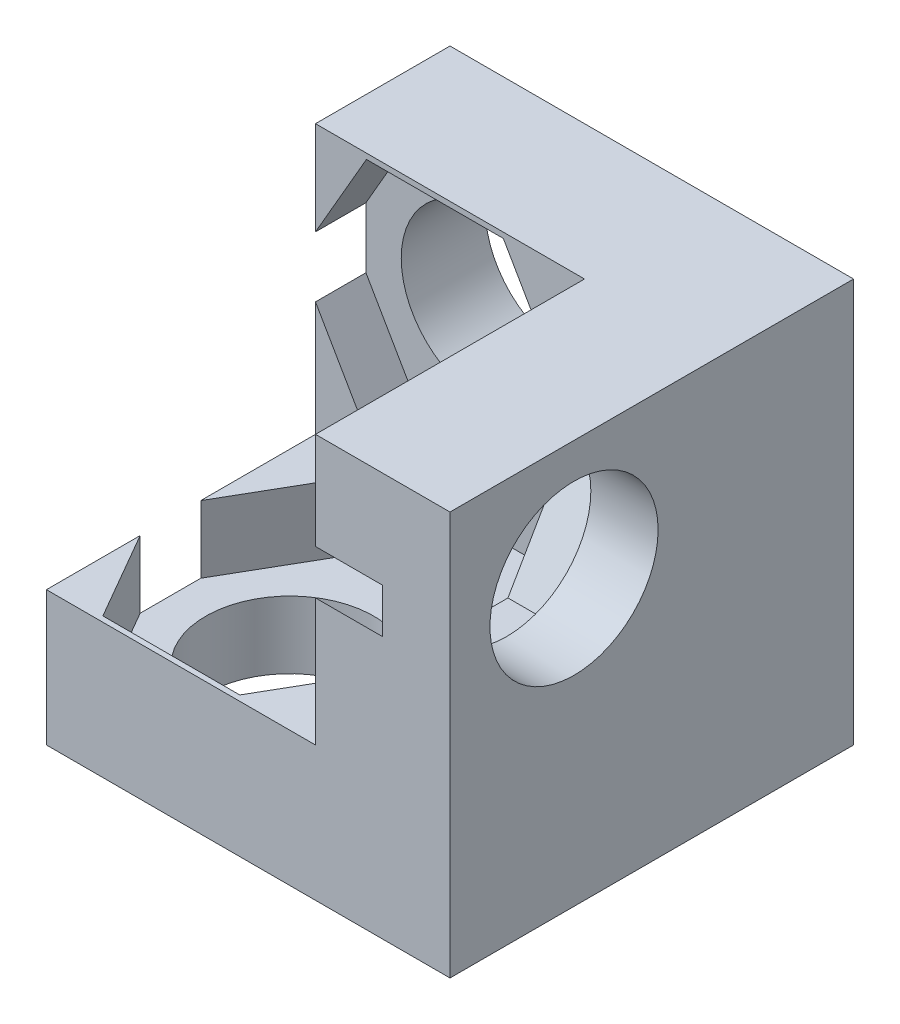
from build123d import *

# Parameters (mm, degrees)
BOSS_EXTRUDE1_DEPTH = 12
SKETCH3_W           = 8
SKETCH3_H           = 8
CUT_EXTRUDE1_DEPTH  = 8
CUT_EXTRUDE8_DEPTH  = 16.620499352
SKETCH8_R           = 2.5
CUT_EXTRUDE9_DEPTH  = 19
CUT_EXTRUDE10_DEPTH = 15.696938457
CUT_EXTRUDE11_START = -2.5
CUT_EXTRUDE11_DEPTH = 10
CUT_EXTRUDE13_DEPTH = 2
CUT_EXTRUDE14_DEPTH = 2


with BuildPart() as part:
    # Sketch2 → Boss-Extrude1 (new body)
    with BuildSketch(Plane.XY):
        with BuildLine():
            Line((2.31217259, 6), (-6, 6))
            Line((-6, 6), (-6, -2.44974747))
            Line((-6, -2.44974747), (0.26217259, -2.44974747))
            ThreePointArc((0.26217259, -2.44974747), (0.862603689, -1.000178569), (2.31217259, -0.39974747))
            Line((2.31217259, -0.39974747), (2.31217259, 6))
        make_face()
        with BuildLine():
            Line((6, 6), (2.31217259, 6))
            Line((2.31217259, 6), (2.31217259, -0.39974747))
            ThreePointArc((2.31217259, -0.39974747), (3.761741491, -1.000178569), (4.36217259, -2.44974747))
            Line((4.36217259, -2.44974747), (6, -2.44974747))
            Line((6, -2.44974747), (6, 6))
        make_face()
        with BuildLine():
            ThreePointArc((2.31217259, -0.39974747), (0.862603689, -1.000178569), (0.26217259, -2.44974747))
            Line((0.26217259, -2.44974747), (2.31217259, -2.44974747))
            Line((2.31217259, -2.44974747), (2.31217259, -0.39974747))
        make_face()
        with BuildLine():
            Line((2.31217259, -2.44974747), (0.26217259, -2.44974747))
            ThreePointArc((0.26217259, -2.44974747), (0.862603689, -3.899316371), (2.31217259, -4.49974747))
            Line((2.31217259, -4.49974747), (2.31217259, -2.44974747))
        make_face()
        with BuildLine():
            ThreePointArc((4.36217259, -2.44974747), (3.761741491, -1.000178569), (2.31217259, -0.39974747))
            Line((2.31217259, -0.39974747), (2.31217259, -2.44974747))
            Line((2.31217259, -2.44974747), (4.36217259, -2.44974747))
        make_face()
        with BuildLine():
            Line((4.36217259, -2.44974747), (2.31217259, -2.44974747))
            Line((2.31217259, -2.44974747), (2.31217259, -4.49974747))
            ThreePointArc((2.31217259, -4.49974747), (3.761741491, -3.899316371), (4.36217259, -2.44974747))
        make_face()
        with BuildLine():
            Line((2.31217259, -4.49974747), (2.31217259, -6))
            Line((2.31217259, -6), (6, -6))
            Line((6, -6), (6, -2.44974747))
            Line((6, -2.44974747), (4.36217259, -2.44974747))
            ThreePointArc((4.36217259, -2.44974747), (3.761741491, -3.899316371), (2.31217259, -4.49974747))
        make_face()
        with BuildLine():
            Line((0.26217259, -2.44974747), (-6, -2.44974747))
            Line((-6, -2.44974747), (-6, -6))
            Line((-6, -6), (2.31217259, -6))
            Line((2.31217259, -6), (2.31217259, -4.49974747))
            ThreePointArc((2.31217259, -4.49974747), (0.862603689, -3.899316371), (0.26217259, -2.44974747))
        make_face()
    extrude(amount=BOSS_EXTRUDE1_DEPTH)

    # Sketch3 → Cut-Extrude1 (cut)
    with BuildSketch(Plane(origin=(0, 6, 0), x_dir=(1, 0, 0), z_dir=(0, 1, 0))):
        with Locations((-2, -8)):
            Rectangle(SKETCH3_W, SKETCH3_H)
    extrude(amount=-CUT_EXTRUDE1_DEPTH, mode=Mode.SUBTRACT)

    # Sketch6 → Cut-Extrude8 (cut, through all)
    with BuildSketch(Plane(origin=(0, -2, 0), x_dir=(1, 0, 0), z_dir=(0, 1, 0))):
        with BuildLine():
            ThreePointArc((0.05025253, -8.31217259), (-0.681980517, -6.544405637), (-2.44974747, -5.81217259))
            Line((-2.44974747, -5.81217259), (-2.44974747, -8.31217259))
            Line((-2.44974747, -8.31217259), (0.05025253, -8.31217259))
        make_face()
        with BuildLine():
            Line((-2.44974747, -8.31217259), (-2.44974747, -5.81217259))
            ThreePointArc((-2.44974747, -5.81217259), (-4.217514423, -6.544405637), (-4.94974747, -8.31217259))
            Line((-4.94974747, -8.31217259), (-2.44974747, -8.31217259))
        make_face()
        with BuildLine():
            ThreePointArc((-2.44974747, -10.81217259), (-0.681980517, -10.079939543), (0.05025253, -8.31217259))
            Line((0.05025253, -8.31217259), (-2.44974747, -8.31217259))
            Line((-2.44974747, -8.31217259), (-2.44974747, -10.81217259))
        make_face()
        with BuildLine():
            Line((-2.44974747, -10.81217259), (-2.44974747, -8.31217259))
            Line((-2.44974747, -8.31217259), (-4.94974747, -8.31217259))
            ThreePointArc((-4.94974747, -8.31217259), (-4.217514423, -10.079939543), (-2.44974747, -10.81217259))
        make_face()
    extrude(amount=-CUT_EXTRUDE8_DEPTH, mode=Mode.SUBTRACT)

    # Sketch8 → Cut-Extrude9 (cut, through all)
    with BuildSketch(Plane(origin=(6, 0, 0), x_dir=(0, 0, -1), z_dir=(1, 0, 0))):
        with Locations((-8.31217259, 2.44974747)):
            Circle(SKETCH8_R)
    extrude(amount=-CUT_EXTRUDE9_DEPTH, mode=Mode.SUBTRACT)

    # Sketch7 → Cut-Extrude10 (cut, through all)
    with BuildSketch(Plane(origin=(0, 0, 0), x_dir=(-1, 0, 0), z_dir=(0, 0, -1))):
        with BuildLine():
            ThreePointArc((-0.05025253, 2.31217259), (0.681980517, 0.544405637), (2.44974747, -0.18782741))
            Line((2.44974747, -0.18782741), (2.44974747, 2.31217259))
            Line((2.44974747, 2.31217259), (-0.05025253, 2.31217259))
        make_face()
        with BuildLine():
            Line((2.44974747, 2.31217259), (2.44974747, -0.18782741))
            ThreePointArc((2.44974747, -0.18782741), (4.217514423, 0.544405637), (4.94974747, 2.31217259))
            Line((4.94974747, 2.31217259), (2.44974747, 2.31217259))
        make_face()
        with BuildLine():
            ThreePointArc((2.44974747, 4.81217259), (0.681980517, 4.079939543), (-0.05025253, 2.31217259))
            Line((-0.05025253, 2.31217259), (2.44974747, 2.31217259))
            Line((2.44974747, 2.31217259), (2.44974747, 4.81217259))
        make_face()
        with BuildLine():
            Line((2.44974747, 4.81217259), (2.44974747, 2.31217259))
            Line((2.44974747, 2.31217259), (4.94974747, 2.31217259))
            ThreePointArc((4.94974747, 2.31217259), (4.217514423, 4.079939543), (2.44974747, 4.81217259))
        make_face()
    extrude(amount=-CUT_EXTRUDE10_DEPTH, mode=Mode.SUBTRACT)

    # Sketch14 → Cut-Extrude11 (cut)
    with BuildSketch(Plane(origin=(0, 0, 0), x_dir=(-1, 0, 0), z_dir=(0, 0, -1)).offset(CUT_EXTRUDE11_START)):
        Polygon((6.520066868, 2.31217259), (4.484907169, 5.83717259), (0.414587771, 5.83717259), (-1.620571928, 2.31217259), (0.414587771, -1.21282741), (4.484907169, -1.21282741), align=None)
    extrude(amount=-CUT_EXTRUDE11_DEPTH, mode=Mode.SUBTRACT)

    # Sketch15 → Cut-Extrude13 (cut)
    with BuildSketch(Plane(origin=(0, -2, 0), x_dir=(1, 0, 0), z_dir=(0, 1, 0))):
        Polygon((1.620571928, -8.31217259), (-0.414587771, -4.78717259), (-4.484907169, -4.78717259), (-6.520066868, -8.31217259), (-4.484907169, -11.83717259), (-0.414587771, -11.83717259), align=None)
    extrude(amount=-CUT_EXTRUDE13_DEPTH, mode=Mode.SUBTRACT)

    # Sketch16 → Cut-Extrude14 (cut)
    with BuildSketch(Plane.ZY.offset(-2)):
        Polygon((12.382491988, 2.44974747), (10.347332289, 5.97474747), (6.277012891, 5.97474747), (4.241853192, 2.44974747), (6.277012891, -1.07525253), (10.347332289, -1.07525253), align=None)
    extrude(amount=-CUT_EXTRUDE14_DEPTH, mode=Mode.SUBTRACT)


solid = part.part
